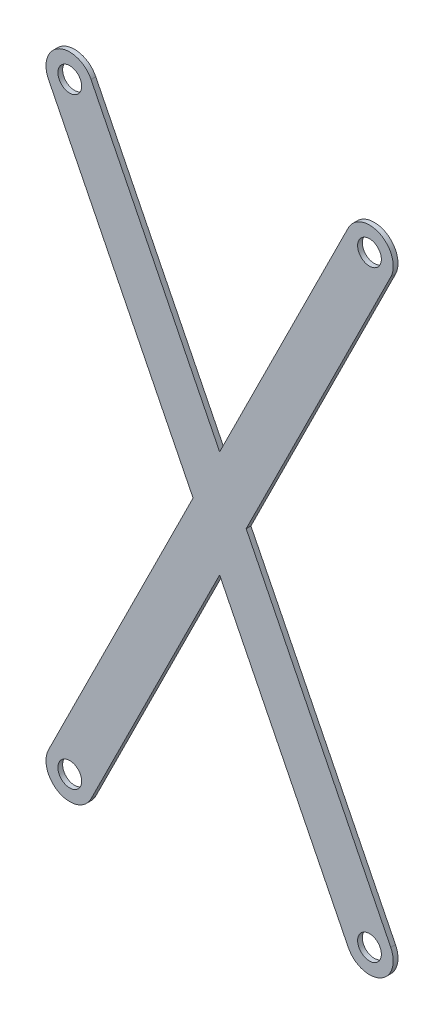
from build123d import *

# Parameters (mm, degrees)
SKETCH_2_R      = 7.5
EXTRUDE_1_DEPTH = 3


with BuildPart() as part:
    # 草图2 → 凸台-拉伸1 (new body)
    with BuildSketch(Plane.XY):
        with BuildLine():
            Line((-13.426802427, 6.687374417), (77.874173312, 190))
            Line((77.874173312, 190), (-13.426802427, 373.312625583))
            ThreePointArc((-13.426802427, 373.312625583), (-6.687374417, 393.426802427), (13.426802427, 386.687374417))
            Line((13.426802427, 386.687374417), (94.6317, 223.645491634))
            Line((94.6317, 223.645491634), (175.836597573, 386.687374417))
            ThreePointArc((175.836597573, 386.687374417), (195.950774417, 393.426802427), (202.690202427, 373.312625583))
            Line((202.690202427, 373.312625583), (111.389226688, 190))
            Line((111.389226688, 190), (202.690202427, 6.687374417))
            ThreePointArc((202.690202427, 6.687374417), (195.950774417, -13.426802427), (175.836597573, -6.687374417))
            Line((175.836597573, -6.687374417), (94.6317, 156.354508366))
            Line((94.6317, 156.354508366), (13.426802427, -6.687374417))
            ThreePointArc((13.426802427, -6.687374417), (-6.687374417, -13.426802427), (-13.426802427, 6.687374417))
        make_face()
        Circle(SKETCH_2_R, mode=Mode.SUBTRACT)
        with Locations((189.2634, 380)):
            Circle(SKETCH_2_R, mode=Mode.SUBTRACT)
        with Locations((189.2634, 0)):
            Circle(SKETCH_2_R, mode=Mode.SUBTRACT)
        with Locations((0, 380)):
            Circle(SKETCH_2_R, mode=Mode.SUBTRACT)
    extrude(amount=EXTRUDE_1_DEPTH)


solid = part.part
